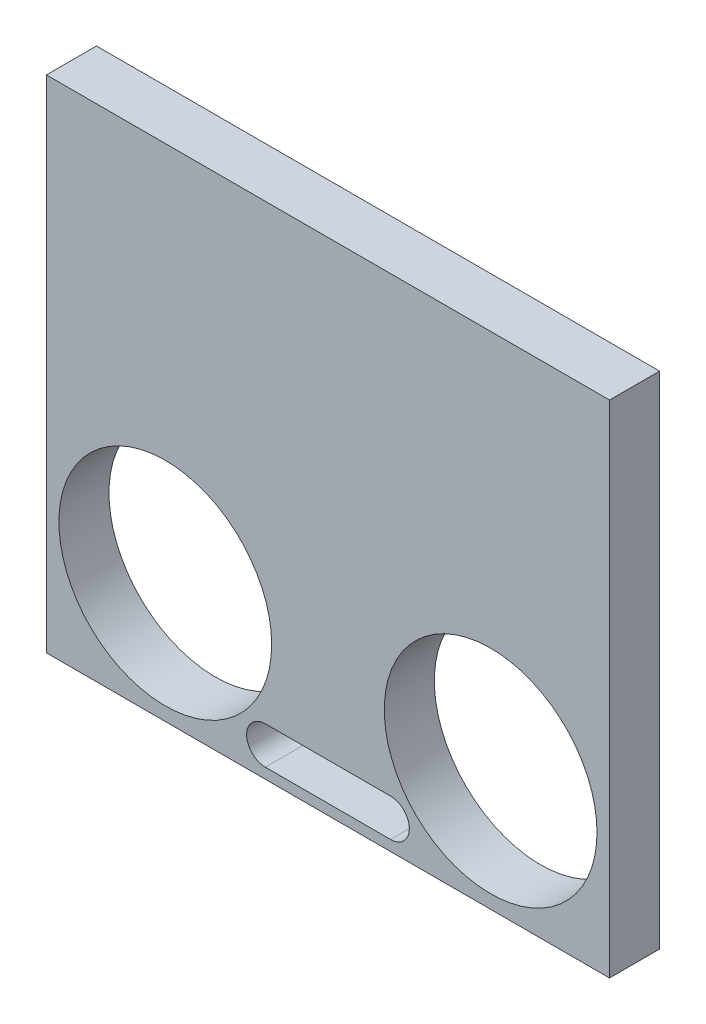
from build123d import *

# Parameters (mm, degrees)
SKETCH1_W           = 45
SKETCH1_H           = 40
SKETCH1_R           = 8.5
BOSS_EXTRUDE1_DEPTH = 4


with BuildPart() as part:
    # Sketch1 → Boss-Extrude1 (new body)
    with BuildSketch(Plane.XY):
        with Locations((9.060125954, 1.991341991)):
            Rectangle(SKETCH1_W, SKETCH1_H)
        with Locations((22.060125954, -8.430649432)):
            Circle(SKETCH1_R, mode=Mode.SUBTRACT)
        with Locations((-3.939874046, -8.430649432)):
            Circle(SKETCH1_R, mode=Mode.SUBTRACT)
        with BuildLine():
            Line((4.060125954, -14.169873575), (14.060125954, -14.169873575))
            ThreePointArc((14.060125954, -14.169873575), (15.560125954, -15.669873575), (14.060125954, -17.169873575))
            Line((14.060125954, -17.169873575), (4.060125954, -17.169873575))
            ThreePointArc((4.060125954, -17.169873575), (2.560125954, -15.669873575), (4.060125954, -14.169873575))
        make_face(mode=Mode.SUBTRACT)
    extrude(amount=BOSS_EXTRUDE1_DEPTH)


solid = part.part
